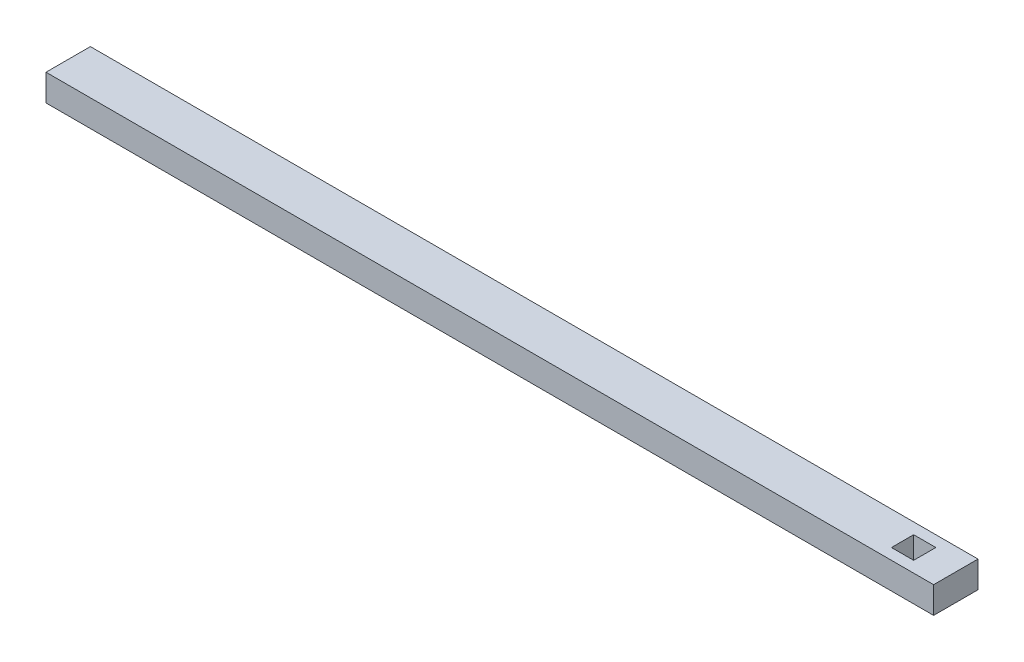
from build123d import *

# Parameters (mm, degrees)
SKETCH1_W           = 200
SKETCH1_H           = 10
BOSS_EXTRUDE1_DEPTH = 6
SKETCH2_W           = 5
SKETCH2_H           = 5
CUT_EXTRUDE1_DEPTH  = 101.304536288


with BuildPart() as part:
    # Sketch1 → Boss-Extrude1 (new body)
    with BuildSketch(Plane(origin=(0, 0, 0), x_dir=(1, 0, 0), z_dir=(0, 1, 0))):
        Rectangle(SKETCH1_W, SKETCH1_H)
    extrude(amount=BOSS_EXTRUDE1_DEPTH)

    # Sketch2 → Cut-Extrude1 (cut, through all)
    with BuildSketch(Plane(origin=(0, 6, 0), x_dir=(1, 0, 0), z_dir=(0, 1, 0))):
        with Locations((90.5, 0)):
            Rectangle(SKETCH2_W, SKETCH2_H)
    extrude(amount=-CUT_EXTRUDE1_DEPTH, mode=Mode.SUBTRACT)


solid = part.part
